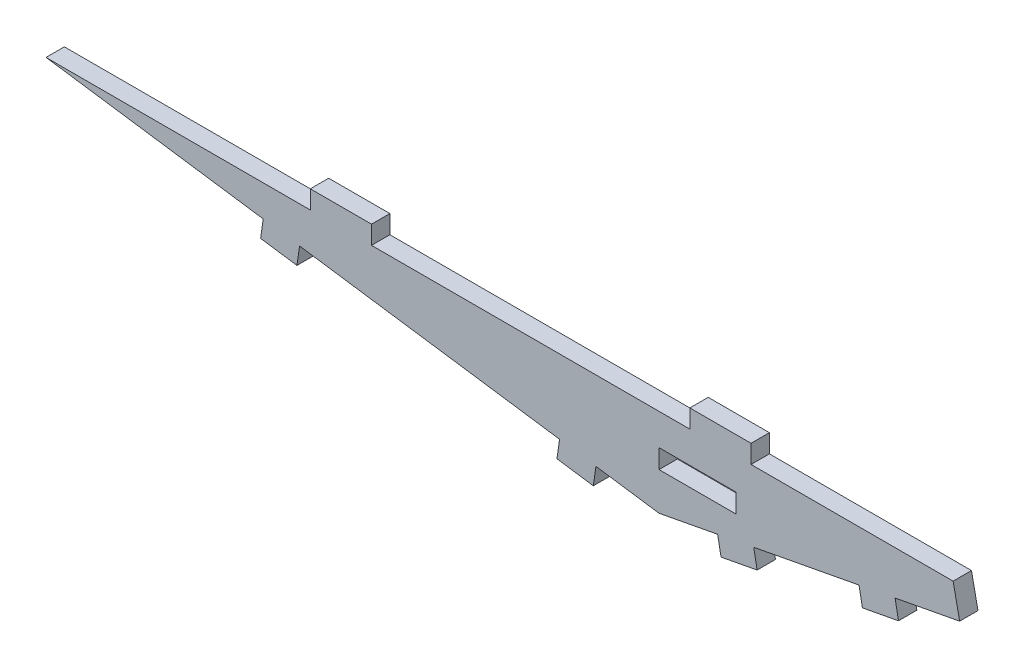
from build123d import *

# Parameters (mm, degrees)
SKETCH1_W           = 6.398334728
SKETCH1_H           = 1.579308664
BOSS_EXTRUDE1_DEPTH = 1.524


with BuildPart() as part:
    # Sketch1 → Boss-Extrude1 (new body)
    with BuildSketch(Plane.XY):
        Polygon((-23.403233798, -4.133198011), (-28.761615364, -5.146272329), (-28.478498191, -6.643743753), (-31.47344104, -7.209978099), (-31.756558213, -5.712506675), (-40.495294208, -7.364682597), (-40.212177035, -8.862154021), (-43.207119883, -9.428388367), (-43.490237056, -7.930916943), (-48.355985293, -8.850852284), (-53.593355447, -8.096704042), (-53.810561584, -9.605146117), (-56.827445734, -9.170733844), (-56.610239597, -7.662291769), (-78.191926721, -4.554665056), (-78.409132858, -6.063107132), (-81.426017008, -5.628694858), (-81.208810872, -4.120252783), (-99.239134473, -1.524), (-77.300143281, -1.524), (-77.300143281, 0), (-72.220143281, 0), (-72.220143281, -1.524), (-45.797700006, -1.524), (-45.797700006, 0), (-40.717700006, 0), (-40.717700006, -1.524), (-23.943865748, -1.524), align=None)
        with Locations((-45.156817929, -4.922852343)):
            Rectangle(SKETCH1_W, SKETCH1_H, mode=Mode.SUBTRACT)
    extrude(amount=-BOSS_EXTRUDE1_DEPTH)


solid = part.part
